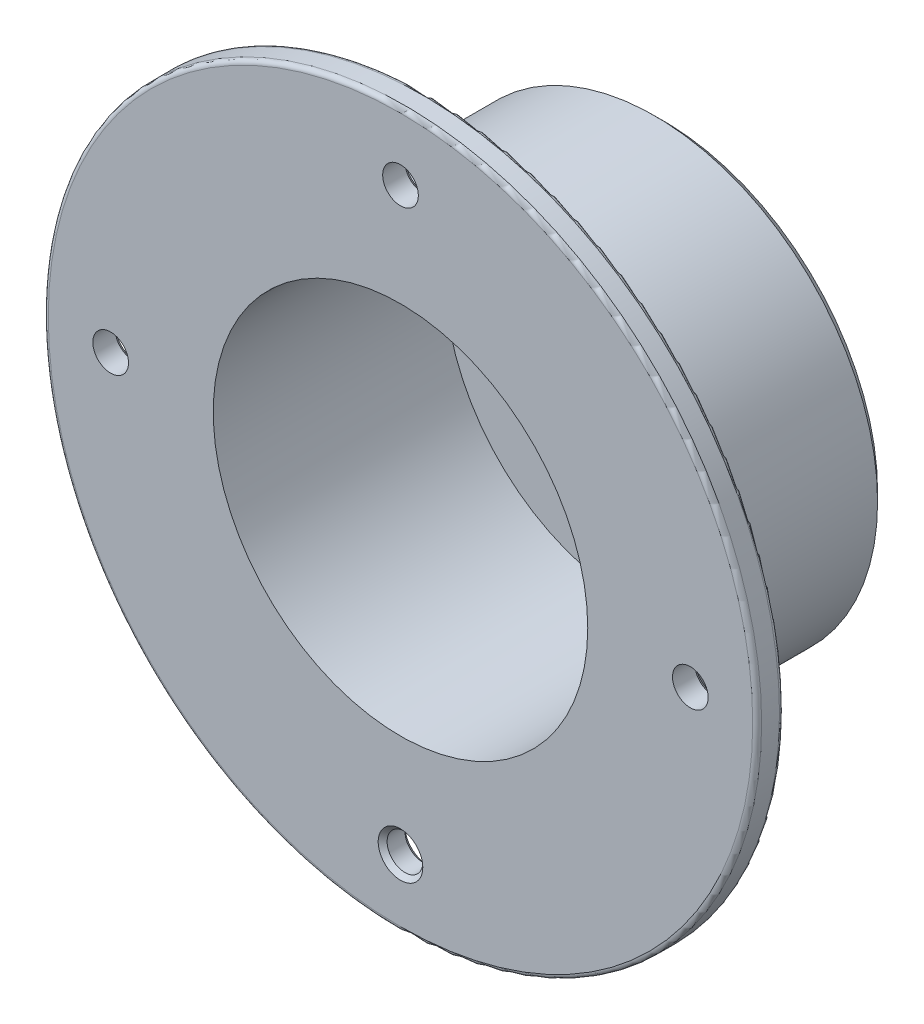
from build123d import *

# Parameters (mm, degrees)
SKETCH1_R           = 25
BOSS_EXTRUDE1_DEPTH = 29.5
SKETCH2_R           = 40
BOSS_EXTRUDE2_DEPTH = 3
CHAMFER1_SIZE       = 1
SKETCH3_R           = 21
CUT_EXTRUDE1_DEPTH  = 26
FILLET1_R           = 0.5
SKETCH4_R           = 2
CUT_EXTRUDE2_DEPTH  = 26
CIRPATTERN1_COUNT   = 4
CHAMFER2_SIZE       = 0.5


with BuildPart() as part:
    # Sketch1 → Boss-Extrude1 (new body)
    with BuildSketch(Plane.XY):
        Circle(SKETCH1_R)
    extrude(amount=BOSS_EXTRUDE1_DEPTH)

    # Sketch2 → Boss-Extrude2 (add)
    with BuildSketch(Plane.XY.offset(29.5)):
        Circle(SKETCH2_R)
    extrude(amount=-BOSS_EXTRUDE2_DEPTH)

    # Chamfer1
    chamfer1_edges = [part.edges().sort_by_distance(p)[0] for p in [
        (-25, 0, 0),
        (-25, 0, 26.5),
    ]]
    chamfer(chamfer1_edges, length=CHAMFER1_SIZE)

    # Sketch3 → Cut-Extrude1 (cut)
    with BuildSketch(Plane.XY.offset(29.5)):
        Circle(SKETCH3_R)
    extrude(amount=-CUT_EXTRUDE1_DEPTH, mode=Mode.SUBTRACT)

    # Fillet1
    fillet1_edges = [part.edges().sort_by_distance(p)[0] for p in [
        (-40, 0, 26.5),
        (-40, 0, 29.5),
    ]]
    fillet(fillet1_edges, radius=FILLET1_R)

    # Sketch4 → Cut-Extrude2 (cut)
    with BuildSketch(Plane(origin=(0, 0, 26.5), x_dir=(-1, 0, 0), z_dir=(0, 0, -1))):
        with Locations((0, 32.5)):
            Circle(SKETCH4_R)
    cut_extrude2 = extrude(amount=-CUT_EXTRUDE2_DEPTH, mode=Mode.SUBTRACT)

    # CirPattern1: Cut-Extrude2 ×4 about axis
    cirpattern1_axis = Axis((0, 0, 0), (0, 0, 1))
    for i in range(1, CIRPATTERN1_COUNT):
        add(cut_extrude2.rotate(cirpattern1_axis, i * 360 / CIRPATTERN1_COUNT), mode=Mode.SUBTRACT)

    # Chamfer2
    chamfer2_edges = [part.edges().sort_by_distance(p)[0] for p in [
        (2, 32.5, 26.5),
        (32.5, -2, 26.5),
        (-2, -32.5, 29.5),
        (-2, -32.5, 26.5),
        (-32.5, 2, 26.5),
    ]]
    chamfer(chamfer2_edges, length=CHAMFER2_SIZE)


solid = part.part
